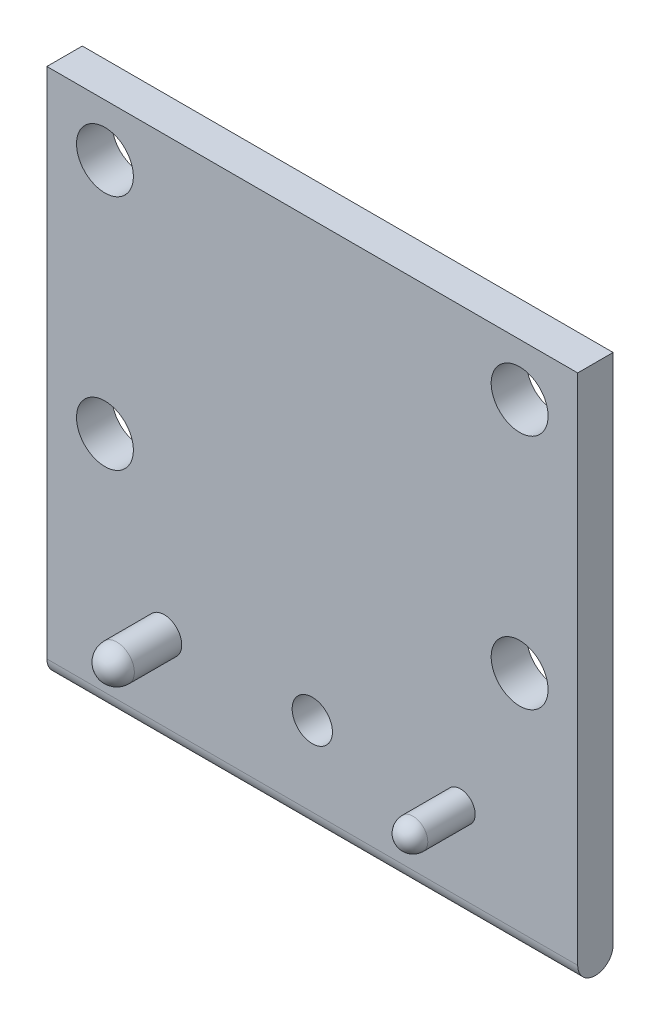
from build123d import *

# Parameters (mm, degrees)
SKETCH1_W            = 44.8
SKETCH1_H            = 2.99
BOSS_EXTRUDE1_DEPTH  = 44.8
FILLET1_RADIUS       = 1.495
FILLET1_LENGTH       = 44.8
M4_CLEARANCE_HOLE1_D = 4.8
M3_CLEARANCE_HOLE1_D = 3.4
SKETCH8_R            = 1.481852537
SKETCH8_R_2          = 1.249642824
BOSS_EXTRUDE2_DEPTH  = 4
REVOLVE1_ANGLE       = 180
REVOLVE2_ANGLE       = 180


with BuildPart() as part:
    # Sketch1 → Boss-Extrude1 (new body)
    with BuildSketch(Plane(origin=(0, 0, 0), x_dir=(1, 0, 0), z_dir=(0, 1, 0))):
        Rectangle(SKETCH1_W, SKETCH1_H)
    extrude(amount=BOSS_EXTRUDE1_DEPTH)

    # Fillet1: full round fillet: the end face becomes a half cylinder, R = half its width
    fillet1_face = Plane((0, 0, 0), x_dir=(-1, 0, 0), z_dir=(0, -1, 0))  # on the end face: x along it, z out of the body
    fillet1_slab = fillet1_face.offset(-FILLET1_RADIUS / 2) * Box(FILLET1_LENGTH, 2 * FILLET1_RADIUS, FILLET1_RADIUS, mode=Mode.PRIVATE)  # the body's end, R deep
    fillet1_round = Plane((0, 1.495, 0), x_dir=(0, -1, 0), z_dir=(-1, 0, 0)) * Cylinder(FILLET1_RADIUS, FILLET1_LENGTH, mode=Mode.PRIVATE)  # its axis R under the face
    add(fillet1_slab - fillet1_round, mode=Mode.SUBTRACT)

    # M4 Clearance Hole1 (through all)
    with Locations(Plane.XY.offset(1.495)):
        with Locations((-17.5, 40.4), (-17.5, 20.4), (17.5, 20.4), (17.5, 40.4)):
            Hole(M4_CLEARANCE_HOLE1_D / 2)

    # M3 Clearance Hole1 (through all)
    with Locations(Plane.XY.offset(1.495)):
        with Locations((0, 8.2)):
            Hole(M3_CLEARANCE_HOLE1_D / 2)

    # Sketch8 → Boss-Extrude2 (add)
    with BuildSketch(Plane.XY.offset(1.495)):
        with Locations(Location((-12.5, 8.2, 0), (0, 0, 180))):
            Circle(SKETCH8_R)
        with Locations(Location((12.5, 8.2, 0), (0, 0, 180))):
            Circle(SKETCH8_R_2)
    extrude(amount=BOSS_EXTRUDE2_DEPTH)

    # Sketch9 → Revolve1 (revolve)
    with BuildSketch(Plane.XY.offset(5.495)):
        with BuildLine():
            Line((-12.5, 9.681852537), (-12.5, 6.718147463))
            ThreePointArc((-12.5, 6.718147463), (-11.018147463, 8.2), (-12.5, 9.681852537))
        make_face()
    revolve(axis=Axis((-12.5, 9.681852537, 5.495), (0, -1, 0)), revolution_arc=REVOLVE1_ANGLE)

    # Sketch10 → Revolve2 (revolve)
    with BuildSketch(Plane.XY.offset(5.495)):
        with BuildLine():
            Line((12.5, 9.449642824), (12.5, 6.950357176))
            ThreePointArc((12.5, 6.950357176), (13.749642824, 8.2), (12.5, 9.449642824))
        make_face()
    revolve(axis=Axis((12.5, 9.449642824, 5.495), (0, -1, 0)), revolution_arc=REVOLVE2_ANGLE)


solid = part.part
